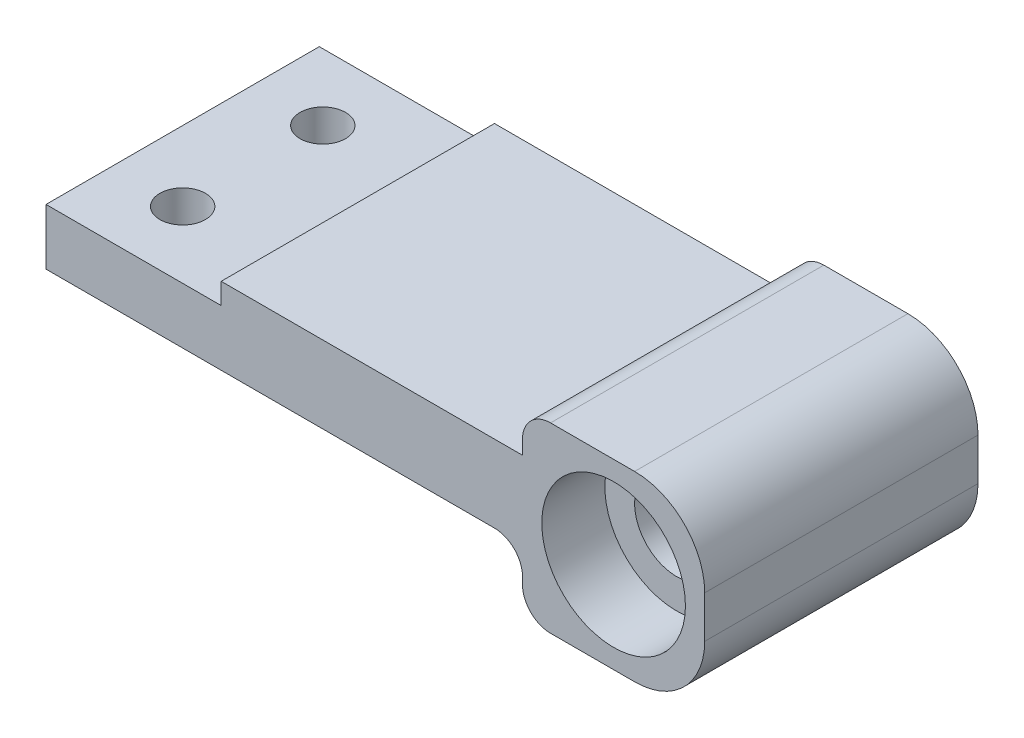
from build123d import *

# Parameters (mm, degrees)
SKETCH1_W                = 13
SKETCH1_H                = 13
BALL_BEARING_BLOCK_DEPTH = 19.5
SKETCH2_W                = 34
SKETCH2_H                = 4
PADDLE_PLATE_DEPTH       = 19.5
SKETCH3_R                = 5.125
BALLBEARING_1_DEPTH      = 4.5
BALLBEARING_START        = -5
SKETCH4_R                = 5.125
BALLBEARING_2_DEPTH      = 5
SKETCH5_R                = 3
ACHSE_DEPTH              = 10
ACHSE_START              = -0.25
SKETCH9_R                = 3
ACHSE_CLOSER_DEPTH       = 0.25
FILLET1_R                = 5
FILLET2_R                = 5
FILLET3_R                = 2
FILLET4_R                = 2
FILLET7_R                = 2
SKETCH6_R                = 1.625
M3_PADDLE_SCREWS_DEPTH   = 4
SKETCH8_W                = 21.5
SKETCH8_H                = 19.5
TOP_PLATE_DEPTH          = 1.5
SKETCH7_R                = 7.75
MAGNET_POCKET_DEPTH      = 3.75


with BuildPart() as part:
    # Sketch1 → Ball Bearing Block (new body)
    with BuildSketch(Plane.XY):
        Rectangle(SKETCH1_W, SKETCH1_H)
    extrude(amount=BALL_BEARING_BLOCK_DEPTH)

    # Sketch2 → Paddle Plate (add)
    with BuildSketch(Plane(origin=(0, 0, 0), x_dir=(1, 0, 0), z_dir=(0, 0, -1))):
        with Locations((-23.5, 0)):
            Rectangle(SKETCH2_W, SKETCH2_H)
    extrude(amount=-PADDLE_PLATE_DEPTH)

    # Sketch3 → Ballbearing 1 (cut)
    with BuildSketch(Plane.XY.offset(19.5)):
        Circle(SKETCH3_R)
    extrude(amount=-BALLBEARING_1_DEPTH, mode=Mode.SUBTRACT)

    # Sketch4 → Ballbearing 2 (cut)
    with BuildSketch(Plane(origin=(0, 0, 0), x_dir=(1, 0, 0), z_dir=(0, 0, -1)).offset(BALLBEARING_START)):
        Circle(SKETCH4_R)
    extrude(amount=BALLBEARING_2_DEPTH, mode=Mode.SUBTRACT)

    # Sketch5 → Achse (cut)
    with BuildSketch(Plane.XY.offset(15)):
        Circle(SKETCH5_R)
    extrude(amount=-ACHSE_DEPTH, mode=Mode.SUBTRACT)

    # Sketch9 → Achse Closer (add)
    with BuildSketch(Plane(origin=(0, 0, 5), x_dir=(-1, 0, 0), z_dir=(0, 0, -1)).offset(ACHSE_START)):
        with Locations(Location((0, 0, 0), (0, 0, 180))):
            Circle(SKETCH9_R)
    extrude(amount=ACHSE_CLOSER_DEPTH)

    # Fillet1
    fillet1_edges = [part.edges().sort_by_distance(p)[0] for p in [
        (6.5, 6.5, 9.75),
    ]]
    fillet(fillet1_edges, radius=FILLET1_R)

    # Fillet2
    fillet2_edges = [part.edges().sort_by_distance(p)[0] for p in [
        (6.5, -6.5, 9.75),
    ]]
    fillet(fillet2_edges, radius=FILLET2_R)

    # Fillet3
    fillet3_edges = [part.edges().sort_by_distance(p)[0] for p in [
        (-6.5, 6.5, 9.75),
    ]]
    fillet(fillet3_edges, radius=FILLET3_R)

    # Fillet4
    fillet4_edges = [part.edges().sort_by_distance(p)[0] for p in [
        (-6.5, -6.5, 9.75),
    ]]
    fillet(fillet4_edges, radius=FILLET4_R)

    # Fillet7
    fillet7_edges = [part.edges().sort_by_distance(p)[0] for p in [
        (-6.5, -2, 9.75),
    ]]
    fillet(fillet7_edges, radius=FILLET7_R)

    # Sketch6 → M3 Paddle Screws (cut)
    with BuildSketch(Plane(origin=(0, 2, 0), x_dir=(-1, 0, 0), z_dir=(0, 1, 0))):
        with Locations(Location((35.5, 4.75, 0), (0, 0, 90))):
            Circle(SKETCH6_R)
        with Locations(Location((35.5, 14.75, 0), (0, 0, 180))):
            Circle(SKETCH6_R)
    extrude(amount=-M3_PADDLE_SCREWS_DEPTH, mode=Mode.SUBTRACT)

    # Sketch8 → Top Plate (add)
    with BuildSketch(Plane(origin=(0, 2, 0), x_dir=(-1, 0, 0), z_dir=(0, 1, 0))):
        with Locations((17.25, 9.75)):
            Rectangle(SKETCH8_W, SKETCH8_H)
    extrude(amount=TOP_PLATE_DEPTH)

    # Sketch7 → Magnet Pocket (cut)
    with BuildSketch(Plane(origin=(0, -2, 0), x_dir=(-1, 0, 0), z_dir=(0, 1, 0))):
        with Locations(Location((19, 9.75, 0), (0, 0, 90))):
            Circle(SKETCH7_R)
    extrude(amount=MAGNET_POCKET_DEPTH, mode=Mode.SUBTRACT)


solid = part.part
